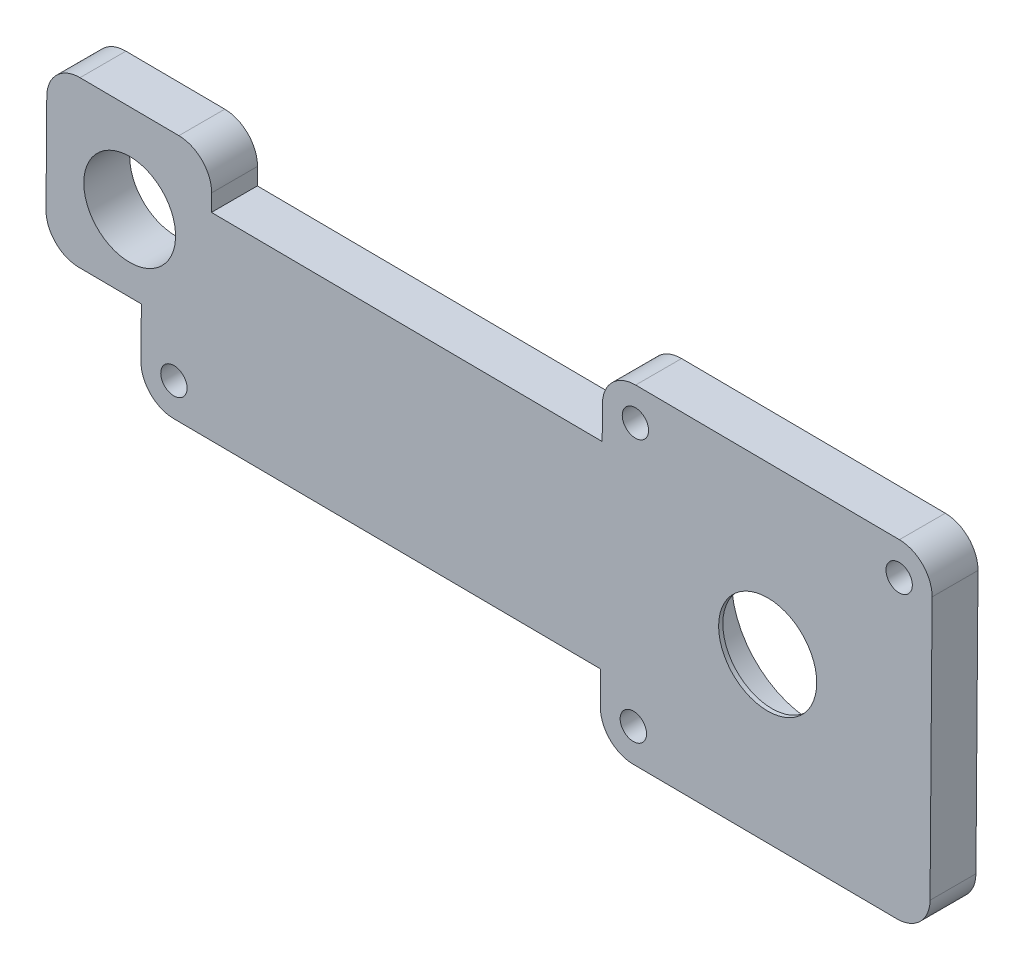
from build123d import *

# Parameters (mm, degrees)
SKETCH4_R                = 4.7244
STOCK_DEPTH              = 4.4196
SKETCH7_R                = 7.8994
CV_GEAR_WELL_DEPTH       = 4.0132
SKETCH8_R                = 2.2987
IDLER_GEAR_WELL_DEPTH    = 4.2926
SKETCH9_R                = 4.4196
SKETCH9_R_2              = 1.27
OUTDRIVE_GEAR_WELL_DEPTH = 4.4196


with BuildPart() as part:
    # Sketch4 → Stock (new body)
    with BuildSketch(Plane.XY):
        with BuildLine():
            Line((17.301339891, -8.805936455), (17.27639382, -11.980838452))
            ThreePointArc((17.27639382, -11.980838452), (18.188661549, -14.233139719), (20.426349746, -15.180686521))
            Line((20.426349746, -15.180686521), (45.825565725, -15.380255093))
            ThreePointArc((45.825565725, -15.380255093), (48.077866993, -14.467987364), (49.025413794, -12.230299167))
            Line((49.025413794, -12.230299167), (49.224982366, 13.168916813))
            ThreePointArc((49.224982366, 13.168916813), (48.312714637, 15.42121808), (46.07502644, 16.368764882))
            Line((46.07502644, 16.368764882), (20.675810461, 16.568333454))
            ThreePointArc((20.675810461, 16.568333454), (18.423509193, 15.656065724), (17.475962392, 13.418377528))
            Line((17.475962392, 13.418377528), (17.45101632, 10.24347553))
            Line((17.45101632, 10.24347553), (-20.178385282, 10.539140008))
            Line((-20.178385282, 10.539140008), (-20.16555609, 12.171919255))
            ThreePointArc((-20.16555609, 12.171919255), (-21.077823819, 14.424220522), (-23.315512016, 15.371767324))
            Line((-23.315512016, 15.371767324), (-32.840218009, 15.446605538))
            ThreePointArc((-32.840218009, 15.446605538), (-35.092519276, 14.534337809), (-36.040066078, 12.296649612))
            Line((-36.040066078, 12.296649612), (-36.114904292, 2.77194362))
            ThreePointArc((-36.114904292, 2.77194362), (-35.202636563, 0.519642353), (-32.964948366, -0.427904449))
            Line((-32.964948366, -0.427904449), (-26.932171442, -0.475305624))
            Line((-26.932171442, -0.475305624), (-26.969946706, -5.282986868))
            ThreePointArc((-26.969946706, -5.282986868), (-26.057678977, -7.535288135), (-23.81999078, -8.482834937))
            Line((-23.81999078, -8.482834937), (17.301339891, -8.805936455))
        make_face()
        with Locations((33.387081626, 0.456569756)):
            Circle(SKETCH4_R, mode=Mode.SUBTRACT)
    extrude(amount=STOCK_DEPTH)

    # Sketch7 → CV Gear Well (cut)
    with BuildSketch(Plane(origin=(0, 0, 0), x_dir=(-1, 0, 0), z_dir=(0, 0, -1))):
        with Locations((-33.387081626, 0.456569756)):
            Circle(SKETCH7_R)
    extrude(amount=-CV_GEAR_WELL_DEPTH, mode=Mode.SUBTRACT)

    # Sketch8 → Idler Gear Well (cut)
    with BuildSketch(Plane(origin=(0, 0, 0), x_dir=(-1, 0, 0), z_dir=(0, 0, -1))):
        with Locations((-12.305081626, 0.456569756)):
            Circle(SKETCH8_R)
        with Locations((2.477718374, 0.456569756)):
            Circle(SKETCH8_R)
        with Locations((17.260518374, 0.456569756)):
            Circle(SKETCH8_R)
    extrude(amount=-IDLER_GEAR_WELL_DEPTH, mode=Mode.SUBTRACT)

    # Sketch9 → Outdrive Gear Well (cut)
    with BuildSketch(Plane(origin=(0, 0, 0), x_dir=(-1, 0, 0), z_dir=(0, 0, -1))):
        with Locations((28.055981517, 6.851899403)):
            Circle(SKETCH9_R)
        with Locations((-46.050080369, 13.193862884)):
            Circle(SKETCH9_R_2)
        with Locations((-20.650864389, 13.393431456)):
            Circle(SKETCH9_R_2)
        with Locations((-20.451295817, -12.005784524)):
            Circle(SKETCH9_R_2)
        with Locations((23.795044709, -5.307932939)):
            Circle(SKETCH9_R_2)
    extrude(amount=-OUTDRIVE_GEAR_WELL_DEPTH, mode=Mode.SUBTRACT)


solid = part.part
